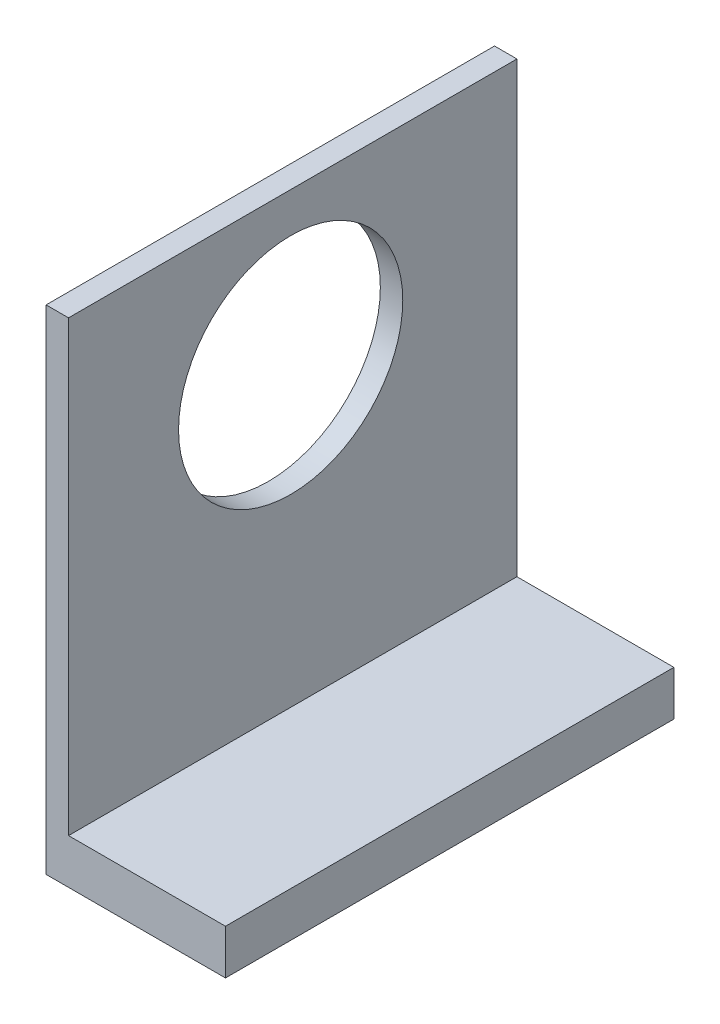
from build123d import *

# Parameters (mm, degrees)
BOSS_EXTRUDE1_DEPTH = 20
SKETCH2_R           = 5
CUT_EXTRUDE1_DEPTH  = 10


with BuildPart() as part:
    # Sketch1 → Boss-Extrude1 (new body)
    with BuildSketch(Plane.XY):
        Polygon((0, 0), (8, 0), (8, 2), (1, 2), (1, 22), (0, 22), align=None)
    extrude(amount=BOSS_EXTRUDE1_DEPTH)

    # Sketch2 → Cut-Extrude1 (cut)
    with BuildSketch(Plane(origin=(1, 0, 0), x_dir=(0, 0, -1), z_dir=(1, 0, 0))):
        with Locations((-10.092962117, 15.222372574)):
            Circle(SKETCH2_R)
    extrude(amount=-CUT_EXTRUDE1_DEPTH, mode=Mode.SUBTRACT)


solid = part.part
